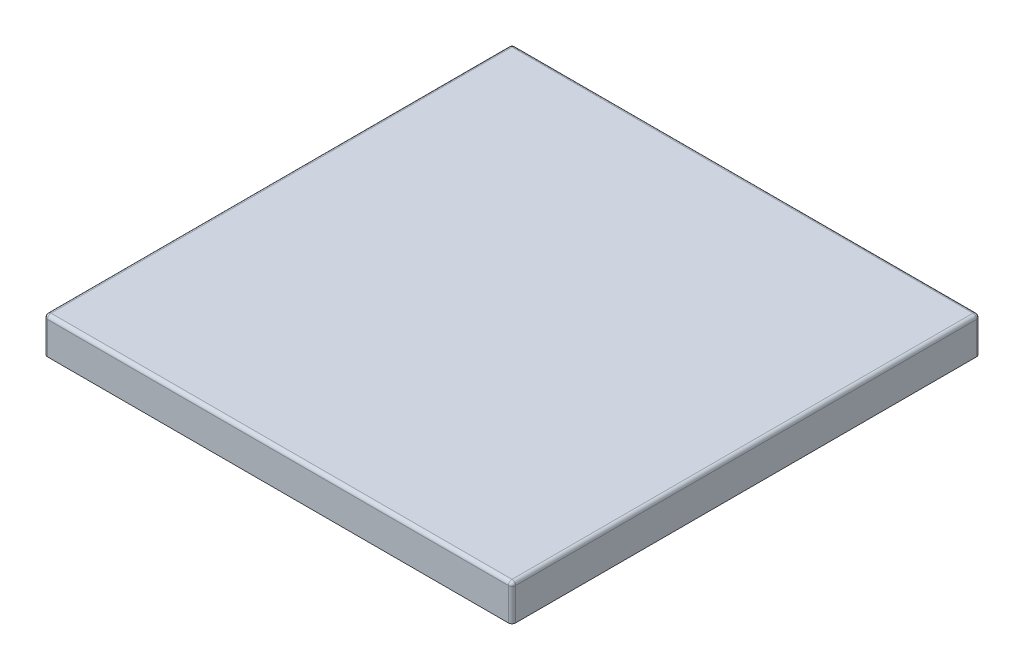
from build123d import *

# Parameters (mm, degrees)
SKETCH1_W           = 130
SKETCH1_H           = 130
BOSS_EXTRUDE1_DEPTH = 10
FILLET1_R           = 1
FILLET2_R           = 1


with BuildPart() as part:
    # Sketch1 → Boss-Extrude1 (new body)
    with BuildSketch(Plane(origin=(0, 0, 0), x_dir=(1, 0, 0), z_dir=(0, 1, 0))):
        Rectangle(SKETCH1_W, SKETCH1_H)
    extrude(amount=BOSS_EXTRUDE1_DEPTH)

    # Fillet1
    fillet1_edges = [part.edges().sort_by_distance(p)[0] for p in [
        (65, 5, 65),
        (-65, 5, 65),
        (-65, 5, -65),
        (65, 5, -65),
    ]]
    fillet(fillet1_edges, radius=FILLET1_R)

    # Fillet2
    fillet2_edges = [part.edges().sort_by_distance(p)[0] for p in [
        (0, 10, 65),
        (-65, 10, 0),
        (65, 10, 0),
        (0, 10, -65),
        (-64.707106781, 10, -64.707106781),
        (64.707106781, 10, -64.707106781),
        (64.707106781, 10, 64.707106781),
        (-64.707106781, 10, 64.707106781),
    ]]
    fillet(fillet2_edges, radius=FILLET2_R)


solid = part.part
